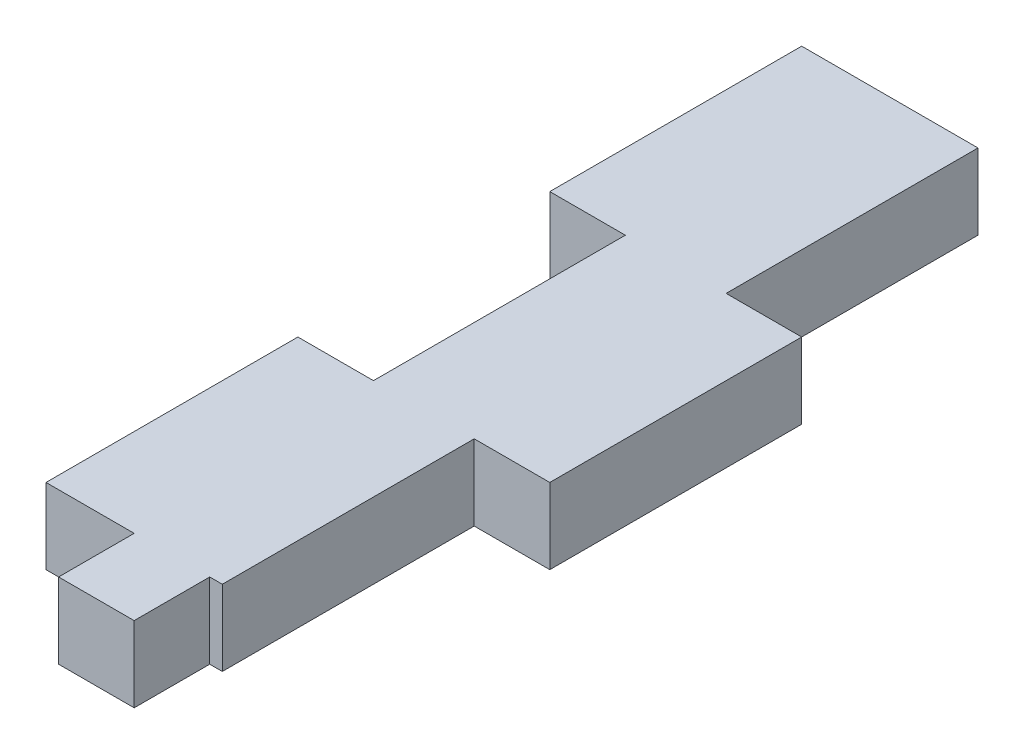
from build123d import *

# Parameters (mm, degrees)
EXTRUDE_1_DEPTH = 3


with BuildPart() as part:
    # 草图1 → 凸台-拉伸1 (new body)
    with BuildSketch(Plane(origin=(0, 0, 0), x_dir=(1, 0, 0), z_dir=(0, 1, 0))):
        Polygon((7, 0), (0, 0), (0, -10), (3, -10), (3, -20), (0, -20), (0, -30), (3.5, -30), (3.5, -33), (6.5, -33), (6.5, -30), (7, -30), (7, -20), (10, -20), (10, -10), (7, -10), align=None)
    extrude(amount=EXTRUDE_1_DEPTH)


solid = part.part
